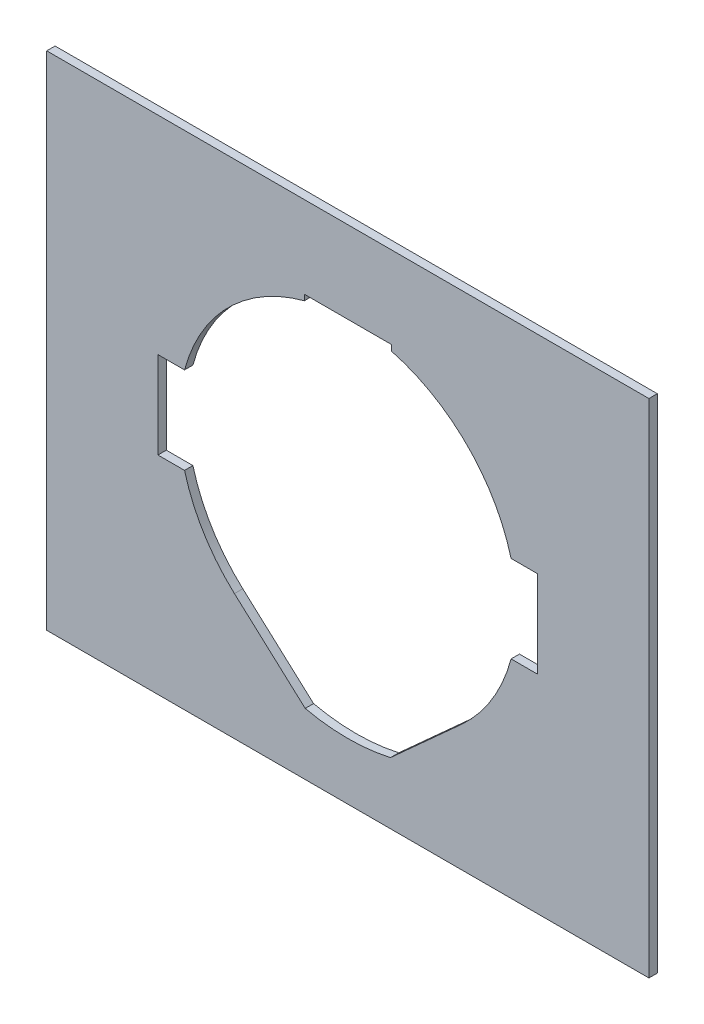
from build123d import *

# Parameters (mm, degrees)
SKETCH_1_W          = 720
SKETCH_1_H          = 600
EXTRUDE_1_DEPTH     = 10
CUT_EXTRUDE_2_DEPTH = 469.72166581


with BuildPart() as part:
    # 草圖1 → 填料-伸長1 (new body)
    with BuildSketch(Plane.XY):
        Rectangle(SKETCH_1_W, SKETCH_1_H)
    extrude(amount=EXTRUDE_1_DEPTH)

    # 草圖2 → 除料-伸長2 (cut, through all)
    with BuildSketch(Plane.XY.offset(10)):
        with BuildLine():
            Line((-227, -52), (-195.192212959, -52))
            ThreePointArc((-195.192212959, -52), (-195.455703203, -51.000667501), (-195.714077164, -50))
            Line((-195.714077164, -50), (-225, -50))
            Line((-225, -50), (-225, 50))
            Line((-225, 50), (-195.714077164, 50))
            ThreePointArc((-195.714077164, 50), (-195.455703203, 51.000667501), (-195.192212959, 52))
            Line((-195.192212959, 52), (-227, 52))
            Line((-227, 52), (-227, -52))
        make_face()
        with BuildLine():
            Line((-225, -50), (-195.714077164, -50))
            ThreePointArc((-195.714077164, -50), (-202, 0), (-195.714077164, 50))
            Line((-195.714077164, 50), (-225, 50))
            Line((-225, 50), (-225, -50))
        make_face()
        with BuildLine():
            ThreePointArc((-193.64916731, 50), (-200, 0), (-193.64916731, -50))
            Line((-193.64916731, -50), (-125, -50))
            Line((-125, -50), (-125, 50))
            Line((-125, 50), (-193.64916731, 50))
        make_face()
        with BuildLine():
            ThreePointArc((-195.714077164, 50), (-202, 0), (-195.714077164, -50))
            Line((-195.714077164, -50), (-193.64916731, -50))
            ThreePointArc((-193.64916731, -50), (-200, 0), (-193.64916731, 50))
            Line((-193.64916731, 50), (-195.714077164, 50))
        make_face()
        with BuildLine():
            ThreePointArc((-193.64916731, 50), (-193.388030784, 51.000681851), (-193.121723273, 52))
            Line((-193.121723273, 52), (-195.192212959, 52))
            ThreePointArc((-195.192212959, 52), (-195.455703203, 51.000667501), (-195.714077164, 50))
            Line((-195.714077164, 50), (-193.64916731, 50))
        make_face()
        with BuildLine():
            ThreePointArc((-193.121723273, 52), (-141.421356237, 141.421356237), (-52, 193.121723273))
            Line((-52, 193.121723273), (-52, 195.192212959))
            ThreePointArc((-52, 195.192212959), (-142.8355698, 142.8355698), (-195.192212959, 52))
            Line((-195.192212959, 52), (-193.121723273, 52))
        make_face()
        with BuildLine():
            ThreePointArc((134.208828858, -148.283479378), (170.598797446, -104.384147791), (193.121723273, -52))
            Line((193.121723273, -52), (123, -52))
            Line((123, -52), (123, 52))
            Line((123, 52), (193.121723273, 52))
            ThreePointArc((193.121723273, 52), (141.421356237, 141.421356237), (52, 193.121723273))
            Line((52, 193.121723273), (52, 98))
            Line((52, 98), (-52, 98))
            Line((-52, 98), (-52, 193.121723273))
            ThreePointArc((-52, 193.121723273), (-141.421356237, 141.421356237), (-193.121723273, 52))
            Line((-193.121723273, 52), (-123, 52))
            Line((-123, 52), (-123, -52))
            Line((-123, -52), (-193.121723273, -52))
            ThreePointArc((-193.121723273, -52), (-170.598797446, -104.384147791), (-134.208828858, -148.283479378))
            Line((-134.208828858, -148.283479378), (-50, -224.499443206))
            ThreePointArc((-50, -224.499443206), (0, -230), (50, -224.499443206))
            Line((50, -224.499443206), (134.208828858, -148.283479378))
        make_face()
        with BuildLine():
            ThreePointArc((-193.64916731, -50), (-193.388030784, -51.000681851), (-193.121723273, -52))
            Line((-193.121723273, -52), (-123, -52))
            Line((-123, -52), (-123, 52))
            Line((-123, 52), (-193.121723273, 52))
            ThreePointArc((-193.121723273, 52), (-193.388030784, 51.000681851), (-193.64916731, 50))
            Line((-193.64916731, 50), (-125, 50))
            Line((-125, 50), (-125, -50))
            Line((-125, -50), (-193.64916731, -50))
        make_face()
        with BuildLine():
            Line((50, 100), (50, 193.64916731))
            ThreePointArc((50, 193.64916731), (25.200858902, 198.405939202), (8.18e-07, 200))
            ThreePointArc((8.18e-07, 200), (-25.200858091, 198.405939305), (-50, 193.64916731))
            Line((-50, 193.64916731), (-50, 100))
            Line((-50, 100), (50, 100))
        make_face()
        with BuildLine():
            Line((52, 98), (52, 193.121723273))
            ThreePointArc((52, 193.121723273), (51.000681851, 193.388030784), (50, 193.64916731))
            Line((50, 193.64916731), (50, 100))
            Line((50, 100), (-50, 100))
            Line((-50, 100), (-50, 193.64916731))
            ThreePointArc((-50, 193.64916731), (-51.000681851, 193.388030784), (-52, 193.121723273))
            Line((-52, 193.121723273), (-52, 98))
            Line((-52, 98), (52, 98))
        make_face()
        with BuildLine():
            ThreePointArc((-50, 195.714077164), (-39.236011871, 198.152808137), (-28.354893758, 200))
            Line((-28.354893758, 200), (-50, 200))
            Line((-50, 200), (-50, 195.714077164))
        make_face()
        with BuildLine():
            ThreePointArc((-28.354893758, 200), (-14.212670404, 201.499379652), (0, 202))
            Line((0, 202), (-52, 202))
            Line((-52, 202), (-52, 195.192212959))
            ThreePointArc((-52, 195.192212959), (-51.000667501, 195.455703203), (-50, 195.714077164))
            Line((-50, 195.714077164), (-50, 200))
            Line((-50, 200), (-28.354893758, 200))
        make_face()
        with BuildLine():
            Line((-52, 195.192212959), (-52, 193.121723273))
            ThreePointArc((-52, 193.121723273), (-51.000681851, 193.388030784), (-50, 193.64916731))
            Line((-50, 193.64916731), (-50, 195.714077164))
            ThreePointArc((-50, 195.714077164), (-51.000667501, 195.455703203), (-52, 195.192212959))
        make_face()
        with BuildLine():
            ThreePointArc((-50, 193.64916731), (-25.200858091, 198.405939305), (8.18e-07, 200))
            Line((8.18e-07, 200), (-28.354893758, 200))
            ThreePointArc((-28.354893758, 200), (-39.236011871, 198.152808137), (-50, 195.714077164))
            Line((-50, 195.714077164), (-50, 193.64916731))
        make_face()
        with BuildLine():
            ThreePointArc((28.354893758, 200), (14.212670404, 201.499379652), (0, 202))
            ThreePointArc((0, 202), (-14.212670404, 201.499379652), (-28.354893758, 200))
            Line((-28.354893758, 200), (8.18e-07, 200))
            Line((8.18e-07, 200), (28.354893758, 200))
        make_face()
        with BuildLine():
            ThreePointArc((50, 195.714077164), (51.000667501, 195.455703203), (52, 195.192212959))
            Line((52, 195.192212959), (52, 202))
            Line((52, 202), (0, 202))
            ThreePointArc((0, 202), (14.212670404, 201.499379652), (28.354893758, 200))
            Line((28.354893758, 200), (50, 200))
            Line((50, 200), (50, 195.714077164))
        make_face()
        with BuildLine():
            Line((50, 193.64916731), (50, 195.714077164))
            ThreePointArc((50, 195.714077164), (39.236011871, 198.152808137), (28.354893758, 200))
            Line((28.354893758, 200), (8.18e-07, 200))
            ThreePointArc((8.18e-07, 200), (25.200858902, 198.405939202), (50, 193.64916731))
        make_face()
        with BuildLine():
            ThreePointArc((28.354893758, 200), (39.236011871, 198.152808137), (50, 195.714077164))
            Line((50, 195.714077164), (50, 200))
            Line((50, 200), (28.354893758, 200))
        make_face()
        with BuildLine():
            Line((52, 193.121723273), (52, 195.192212959))
            ThreePointArc((52, 195.192212959), (51.000667501, 195.455703203), (50, 195.714077164))
            Line((50, 195.714077164), (50, 193.64916731))
            ThreePointArc((50, 193.64916731), (51.000681851, 193.388030784), (52, 193.121723273))
        make_face()
        with BuildLine():
            Line((193.121723273, 52), (195.192212959, 52))
            ThreePointArc((195.192212959, 52), (142.8355698, 142.8355698), (52, 195.192212959))
            Line((52, 195.192212959), (52, 193.121723273))
            ThreePointArc((52, 193.121723273), (141.421356237, 141.421356237), (193.121723273, 52))
        make_face()
        with BuildLine():
            Line((125, -50), (193.64916731, -50))
            ThreePointArc((193.64916731, -50), (200, 0), (193.64916731, 50))
            Line((193.64916731, 50), (125, 50))
            Line((125, 50), (125, -50))
        make_face()
        with BuildLine():
            ThreePointArc((193.121723273, -52), (193.388030784, -51.000681851), (193.64916731, -50))
            Line((193.64916731, -50), (125, -50))
            Line((125, -50), (125, 50))
            Line((125, 50), (193.64916731, 50))
            ThreePointArc((193.64916731, 50), (193.388030784, 51.000681851), (193.121723273, 52))
            Line((193.121723273, 52), (123, 52))
            Line((123, 52), (123, -52))
            Line((123, -52), (193.121723273, -52))
        make_face()
        with BuildLine():
            Line((195.714077164, -50), (225, -50))
            Line((225, -50), (225, 50))
            Line((225, 50), (195.714077164, 50))
            ThreePointArc((195.714077164, 50), (202, 0), (195.714077164, -50))
        make_face()
        with BuildLine():
            Line((193.64916731, -50), (195.714077164, -50))
            ThreePointArc((195.714077164, -50), (202, 0), (195.714077164, 50))
            Line((195.714077164, 50), (193.64916731, 50))
            ThreePointArc((193.64916731, 50), (200, 0), (193.64916731, -50))
        make_face()
        with BuildLine():
            Line((193.64916731, 50), (195.714077164, 50))
            ThreePointArc((195.714077164, 50), (195.455703203, 51.000667501), (195.192212959, 52))
            Line((195.192212959, 52), (193.121723273, 52))
            ThreePointArc((193.121723273, 52), (193.388030784, 51.000681851), (193.64916731, 50))
        make_face()
        with BuildLine():
            Line((225, 50), (225, -50))
            Line((225, -50), (195.714077164, -50))
            ThreePointArc((195.714077164, -50), (195.455703203, -51.000667501), (195.192212959, -52))
            Line((195.192212959, -52), (227, -52))
            Line((227, -52), (227, 52))
            Line((227, 52), (195.192212959, 52))
            ThreePointArc((195.192212959, 52), (195.455703203, 51.000667501), (195.714077164, 50))
            Line((195.714077164, 50), (225, 50))
        make_face()
        with BuildLine():
            ThreePointArc((195.192212959, -52), (195.455703203, -51.000667501), (195.714077164, -50))
            Line((195.714077164, -50), (193.64916731, -50))
            ThreePointArc((193.64916731, -50), (193.388030784, -51.000681851), (193.121723273, -52))
            Line((193.121723273, -52), (195.192212959, -52))
        make_face()
        with BuildLine():
            ThreePointArc((135.550917147, -149.766314172), (172.445114674, -105.198300486), (195.192212959, -52))
            Line((195.192212959, -52), (193.121723273, -52))
            ThreePointArc((193.121723273, -52), (170.598797446, -104.384147791), (134.208828858, -148.283479378))
            Line((134.208828858, -148.283479378), (50, -224.499443206))
            ThreePointArc((50, -224.499443206), (0, -230), (-50, -224.499443206))
            Line((-50, -224.499443206), (-134.208828858, -148.283479378))
            ThreePointArc((-134.208828858, -148.283479378), (-170.598797446, -104.384147791), (-193.121723273, -52))
            Line((-193.121723273, -52), (-195.192212959, -52))
            ThreePointArc((-195.192212959, -52), (-172.445114674, -105.198300486), (-135.550917147, -149.766314172))
            Line((-135.550917147, -149.766314172), (-50.951325963, -226.335950266))
            ThreePointArc((-50.951325963, -226.335950266), (0, -232), (50.951325963, -226.335950266))
            Line((50.951325963, -226.335950266), (135.550917147, -149.766314172))
        make_face()
        with BuildLine():
            ThreePointArc((-195.714077164, -50), (-195.455703203, -51.000667501), (-195.192212959, -52))
            Line((-195.192212959, -52), (-193.121723273, -52))
            ThreePointArc((-193.121723273, -52), (-193.388030784, -51.000681851), (-193.64916731, -50))
            Line((-193.64916731, -50), (-195.714077164, -50))
        make_face()
    extrude(amount=-CUT_EXTRUDE_2_DEPTH, mode=Mode.SUBTRACT)


solid = part.part
